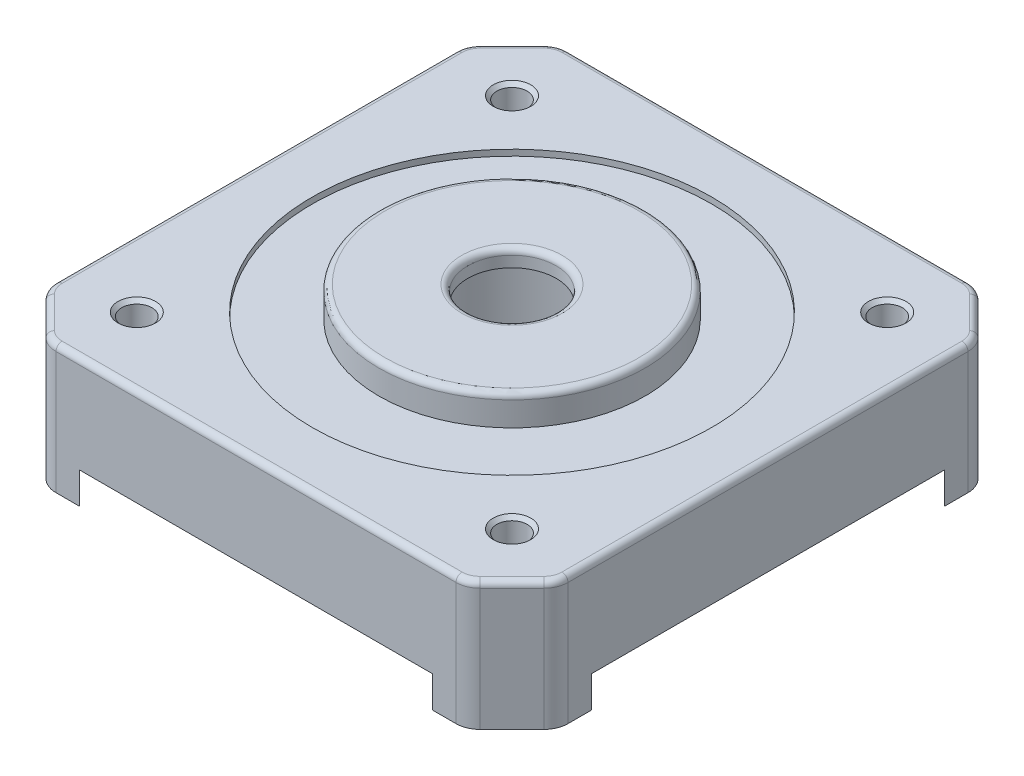
from build123d import *

# Parameters (mm, degrees)
SKETCH_1_R          = 16.5
SKETCH_1_R_2        = 1.25
EXTRUDE_1_DEPTH     = 8
SKETCH_1_3_R        = 16.5
SKETCH_1_3_R_2      = 11
EXTRUDE_2_DEPTH     = 7.5
SKETCH_1_4_R        = 11
SKETCH_1_4_R_2      = 3.65
EXTRUDE_3_DEPTH     = 10
EXTRUDE_4_DEPTH     = 2.6
SKETCH_2_R          = 8
CUT_EXTRUDE_1_DEPTH = 8.6
FILLET_1_R          = 2
FILLET_2_R          = 0.5
CHAMFER_1_SIZE      = 0.3


with BuildPart() as part:
    # Эскиз1 → Бобышка-Вытянуть1 (new body)
    with BuildSketch(Plane(origin=(0, 0, 0), x_dir=(1, 0, 0), z_dir=(0, 1, 0))):
        Polygon((-17.35, 21.15), (-21.15, 17.35), (-21.15, -17.35), (-17.35, -21.15), (17.35, -21.15), (21.15, -17.35), (21.15, 17.35), (17.35, 21.15), align=None)
        Circle(SKETCH_1_R, mode=Mode.SUBTRACT)
        with Locations((15.5, 15.5)):
            Circle(SKETCH_1_R_2, mode=Mode.SUBTRACT)
        with Locations((-15.5, -15.5)):
            Circle(SKETCH_1_R_2, mode=Mode.SUBTRACT)
        with Locations((15.5, -15.5)):
            Circle(SKETCH_1_R_2, mode=Mode.SUBTRACT)
        with Locations((-15.5, 15.5)):
            Circle(SKETCH_1_R_2, mode=Mode.SUBTRACT)
    extrude(amount=EXTRUDE_1_DEPTH)

    # Эскиз1<3> → Бобышка-Вытянуть2 (add)
    with BuildSketch(Plane(origin=(0, 0, 0), x_dir=(1, 0, 0), z_dir=(0, 1, 0))):
        Circle(SKETCH_1_3_R)
        Circle(SKETCH_1_3_R_2, mode=Mode.SUBTRACT)
    extrude(amount=EXTRUDE_2_DEPTH)

    # Эскиз1<4> → Бобышка-Вытянуть3 (add)
    with BuildSketch(Plane(origin=(0, 0, 0), x_dir=(1, 0, 0), z_dir=(0, 1, 0))):
        Circle(SKETCH_1_4_R)
        Circle(SKETCH_1_4_R_2, mode=Mode.SUBTRACT)
    extrude(amount=EXTRUDE_3_DEPTH)

    # Эскиз1<5> → Бобышка-Вытянуть4 (add)
    with BuildSketch(Plane(origin=(0, 0, 0), x_dir=(1, 0, 0), z_dir=(0, 1, 0))):
        with BuildLine():
            Line((-17.35, 21.15), (-21.15, 17.35))
            Line((-21.15, 17.35), (-21.15, 14.600256847))
            ThreePointArc((-21.15, 14.600256847), (-18.172644276, 18.172644276), (-14.600256847, 21.15))
            Line((-14.600256847, 21.15), (-17.35, 21.15))
        make_face()
        with BuildLine():
            ThreePointArc((-14.600256847, -21.15), (-18.172644276, -18.172644276), (-21.15, -14.600256847))
            Line((-21.15, -14.600256847), (-21.15, -17.35))
            Line((-21.15, -17.35), (-17.35, -21.15))
            Line((-17.35, -21.15), (-14.600256847, -21.15))
        make_face()
        with BuildLine():
            Line((17.35, 21.15), (14.600256847, 21.15))
            ThreePointArc((14.600256847, 21.15), (18.172644276, 18.172644276), (21.15, 14.600256847))
            Line((21.15, 14.600256847), (21.15, 17.35))
            Line((21.15, 17.35), (17.35, 21.15))
        make_face()
        with BuildLine():
            ThreePointArc((21.15, -14.600256847), (18.172644276, -18.172644276), (14.600256847, -21.15))
            Line((14.600256847, -21.15), (17.35, -21.15))
            Line((17.35, -21.15), (21.15, -17.35))
            Line((21.15, -17.35), (21.15, -14.600256847))
        make_face()
    extrude(amount=-EXTRUDE_4_DEPTH)

    # Эскиз2 → Вырез-Вытянуть1 (cut)
    with BuildSketch(Plane.XZ):
        Circle(SKETCH_2_R)
    extrude(amount=-CUT_EXTRUDE_1_DEPTH, mode=Mode.SUBTRACT)

    # Скругление1
    fillet_1_edges = [part.edges().sort_by_distance(p)[0] for p in [
        (21.15, 2.7, 17.35),
        (17.35, 2.7, 21.15),
        (-17.35, 2.7, 21.15),
        (-21.15, 2.7, 17.35),
        (-21.15, 2.7, -17.35),
        (-17.35, 2.7, -21.15),
        (17.35, 2.7, -21.15),
        (21.15, 2.7, -17.35),
    ]]
    fillet(fillet_1_edges, radius=FILLET_1_R)

    # Скругление2
    fillet_2_edges = [part.edges().sort_by_distance(p)[0] for p in [
        (-17.28693974, 8, 20.997759065),
        (-19.25, 8, 19.25),
        (-20.997759065, 8, 17.28693974),
        (-21.15, 8, 0),
        (-20.997759065, 8, -17.28693974),
        (-19.25, 8, -19.25),
        (-17.28693974, 8, -20.997759065),
        (0, 8, -21.15),
        (17.28693974, 8, -20.997759065),
        (19.25, 8, -19.25),
        (20.997759065, 8, -17.28693974),
        (21.15, 8, 0),
        (20.997759065, 8, 17.28693974),
        (19.25, 8, 19.25),
        (17.28693974, 8, 20.997759065),
        (0, 8, 21.15),
        (-3.65, 10, 0),
        (-11, 10, 0),
    ]]
    fillet(fillet_2_edges, radius=FILLET_2_R)

    # Фаска1
    chamfer_1_edges = [part.edges().sort_by_distance(p)[0] for p in [
        (-16.75, 8, 15.5),
        (-16.75, 8, -15.5),
        (14.25, 8, -15.5),
        (14.25, 8, 15.5),
    ]]
    chamfer(chamfer_1_edges, length=CHAMFER_1_SIZE)


solid = part.part
